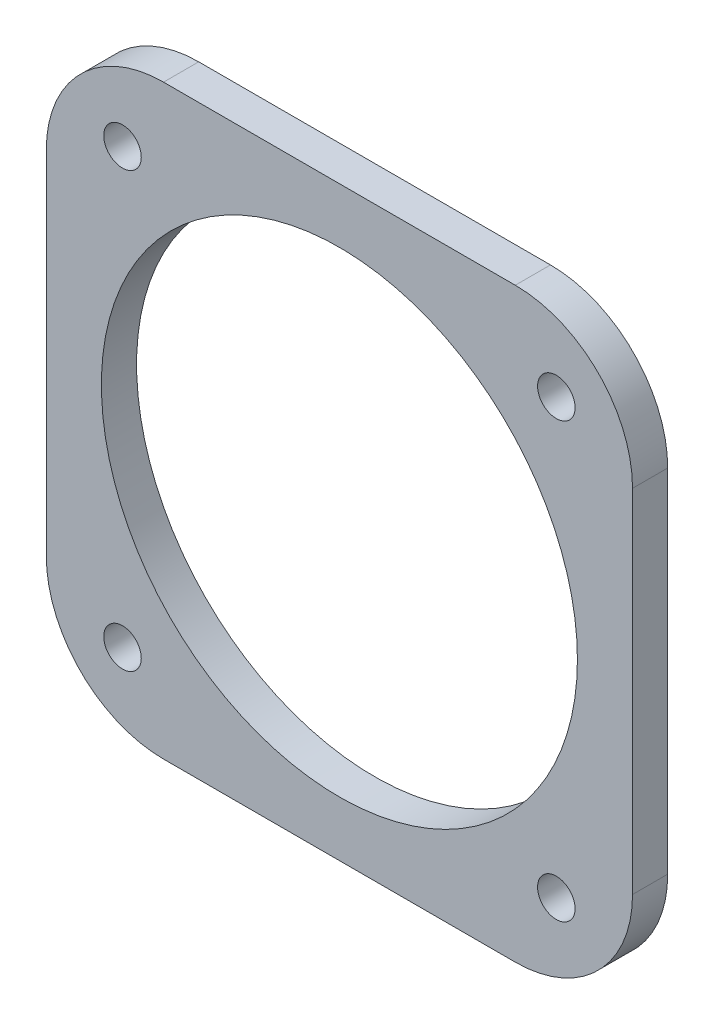
from build123d import *

# Parameters (mm, degrees)
SKETCH_2_W      = 50
SKETCH_2_H      = 50
SKETCH_2_R      = 1.6
SKETCH_2_R_2    = 20.3
EXTRUDE_1_DEPTH = 3
FILLET_1_R      = 10


with BuildPart() as part:
    # 草图2 → 凸台-拉伸1 (new body)
    with BuildSketch(Plane.XY):
        Rectangle(SKETCH_2_W, SKETCH_2_H)
        with Locations((-18.5, 18.5)):
            Circle(SKETCH_2_R, mode=Mode.SUBTRACT)
        with Locations((18.5, 18.5)):
            Circle(SKETCH_2_R, mode=Mode.SUBTRACT)
        with Locations((18.5, -18.5)):
            Circle(SKETCH_2_R, mode=Mode.SUBTRACT)
        with Locations((-18.5, -18.5)):
            Circle(SKETCH_2_R, mode=Mode.SUBTRACT)
        Circle(SKETCH_2_R_2, mode=Mode.SUBTRACT)
    extrude(amount=EXTRUDE_1_DEPTH)

    # 圆角1
    fillet_1_edges = [part.edges().sort_by_distance(p)[0] for p in [
        (25, -25, 1.5),
        (-25, -25, 1.5),
        (-25, 25, 1.5),
        (25, 25, 1.5),
    ]]
    fillet(fillet_1_edges, radius=FILLET_1_R)


solid = part.part
